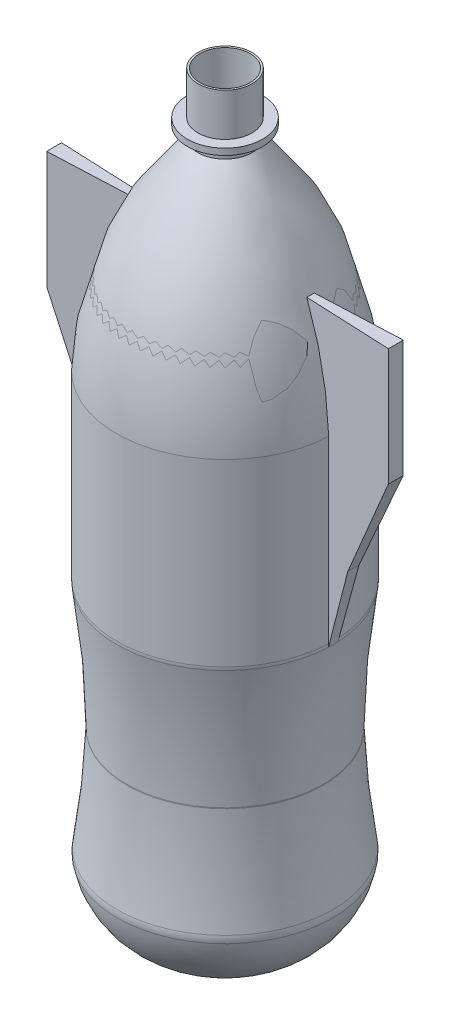
from build123d import *

# Parameters (mm, degrees)
REVOLVE2_ANGLE           = 2.5
REVOLVE2_OTHER_WAY_ANGLE = 2.5


with BuildPart() as part:
    # Sketch2 → Revolve1 (revolve)
    with BuildSketch(Plane.XY, mode=Mode.PRIVATE) as revolve1_sk:
        with BuildLine():
            Line((0, 16), (0, 16.901605051))
            ThreePointArc((0, 16.901605051), (16.441405143, 13.659211714), (29.238507632, 2.839457301))
            ThreePointArc((29.238507632, 2.839457301), (30.553333478, 1.990114544), (32.090379974, 2.286152032))
            ThreePointArc((32.090379974, 2.286152032), (43.562084402, 13.501902531), (49.703151335, 28.323520481))
            ThreePointArc((49.703151335, 28.323520481), (49.866891862, 29.884457449), (49.759980915, 31.450313518))
            ThreePointArc((49.759980915, 31.450313518), (46.751285767, 55.545322959), (45.206851643, 79.778285009))
            ThreePointArc((45.206851643, 79.778285009), (45.201883584, 79.987264375), (45.200924027, 80.196300584))
            ThreePointArc((45.200924027, 80.196300584), (46.449947387, 109.876869843), (49.893372756, 139.383463558))
            ThreePointArc((49.893372756, 139.383463558), (49.973304031, 140.075906787), (50, 140.77243673))
            Line((50, 140.77243673), (50, 224.984670448))
            ThreePointArc((50, 224.984670448), (39.254889748, 275.691159164), (11.8, 319.65517196))
            Line((11.8, 319.65517196), (11.8, 325.9))
            Line((11.8, 325.9), (16.8, 325.9))
            Line((16.8, 325.9), (16.8, 327.1))
            Line((16.8, 327.1), (11.8, 327.1))
            Line((11.8, 327.1), (11.8, 348))
            Line((11.8, 348), (12.7, 348))
            Line((12.7, 348), (12.7, 328))
            Line((12.7, 328), (17.7, 328))
            Line((17.7, 328), (17.7, 325))
            Line((17.7, 325), (12.7, 325))
            Line((12.7, 325), (12.7, 320))
            ThreePointArc((12.7, 320), (40.156992348, 275.860390607), (50.9, 225))
            Line((50.9, 225), (50.9, 140.77243673))
            ThreePointArc((50.9, 140.77243673), (50.87066377, 140.007019211), (50.782827204, 139.246092584))
            ThreePointArc((50.782827204, 139.246092584), (47.347132149, 109.805739664), (46.100912783, 80.191801765))
            ThreePointArc((46.100912783, 80.191801765), (46.101793111, 80.000025427), (46.106350963, 79.808301238))
            ThreePointArc((46.106350963, 79.808301238), (47.647317911, 55.629740948), (50.649258692, 31.588823571))
            ThreePointArc((50.649258692, 31.588823571), (50.766743249, 29.868102617), (50.586808604, 28.152787267))
            ThreePointArc((50.586808604, 28.152787267), (44.307549341, 12.997638686), (32.577697332, 1.529500333))
            ThreePointArc((32.577697332, 1.529500333), (30.381916623, 1.106589637), (28.503593986, 2.319936432))
            ThreePointArc((28.503593986, 2.319936432), (16.027417193, 12.859626262), (0, 16))
        make_face()
    revolve(revolve1_sk.sketch.rotate(Axis((0, 0, 0), (0, 1, 0)), 90), axis=Axis((0, 0, 0), (0, 1, 0)))

    # Sketch3 → Revolve2 (revolve)
    with BuildSketch(Plane.XY):
        with BuildLine():
            Line((-50.782827204, 139.246092584), (-50.9, 225))
            ThreePointArc((-50.9, 225), (-47.748499835, 250.899116522), (-40.156992348, 275.860390607))
            Line((-40.156992348, 275.860390607), (-80.156992348, 275.860390607))
            Line((-80.156992348, 275.860390607), (-80.156992348, 220.860390607))
            Line((-80.156992348, 220.860390607), (-60.259525358, 174.990021005))
            Line((-60.259525358, 174.990021005), (-50.782827204, 139.246092584))
        make_face()
        with BuildLine():
            ThreePointArc((50.9, 225), (47.748499835, 250.899116522), (40.156992348, 275.860390607))
            Line((40.156992348, 275.860390607), (80.156992348, 275.860390607))
            Line((80.156992348, 275.860390607), (80.156992348, 220.860390607))
            Line((80.156992348, 220.860390607), (60.259525358, 174.990021005))
            Line((60.259525358, 174.990021005), (50.782827204, 139.246092584))
            Line((50.782827204, 139.246092584), (50.9, 225))
        make_face()
    revolve(axis=Axis((0, 140.77243673, 0), (0, 1, 0)), revolution_arc=REVOLVE2_ANGLE)

    # Sketch3 → Revolve2 other way (revolve)
    with BuildSketch(Plane.XY):
        with BuildLine():
            Line((-50.782827204, 139.246092584), (-50.9, 225))
            ThreePointArc((-50.9, 225), (-47.748499835, 250.899116522), (-40.156992348, 275.860390607))
            Line((-40.156992348, 275.860390607), (-80.156992348, 275.860390607))
            Line((-80.156992348, 275.860390607), (-80.156992348, 220.860390607))
            Line((-80.156992348, 220.860390607), (-60.259525358, 174.990021005))
            Line((-60.259525358, 174.990021005), (-50.782827204, 139.246092584))
        make_face()
        with BuildLine():
            ThreePointArc((50.9, 225), (47.748499835, 250.899116522), (40.156992348, 275.860390607))
            Line((40.156992348, 275.860390607), (80.156992348, 275.860390607))
            Line((80.156992348, 275.860390607), (80.156992348, 220.860390607))
            Line((80.156992348, 220.860390607), (60.259525358, 174.990021005))
            Line((60.259525358, 174.990021005), (50.782827204, 139.246092584))
            Line((50.782827204, 139.246092584), (50.9, 225))
        make_face()
    revolve(axis=Axis((0, 140.77243673, 0), (0, -1, 0)), revolution_arc=REVOLVE2_OTHER_WAY_ANGLE)


solid = part.part
